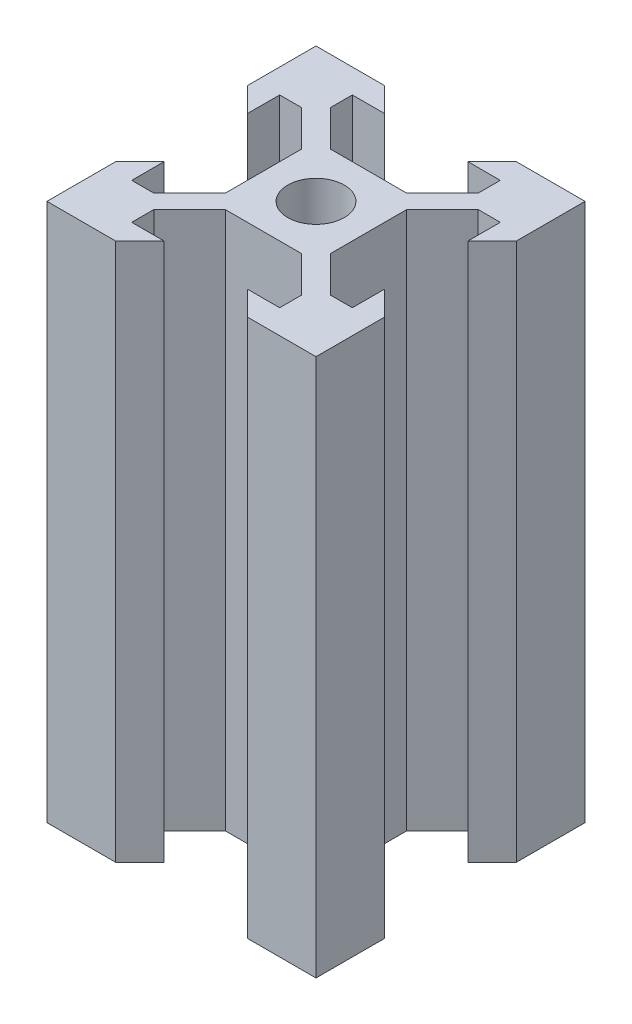
from build123d import *

# Parameters (mm, degrees)
SKETCH1_R           = 2.1
BOSS_EXTRUDE1_DEPTH = 40


with BuildPart() as part:
    # Sketch1 → Boss-Extrude1 (new body)
    with BuildSketch(Plane(origin=(0, 0, 0), x_dir=(1, 0, 0), z_dir=(0, 1, 0))):
        Polygon((-3.900660172, -2.84), (-3.900660172, 0), (-3.900660172, 2.84), (-6.56, 5.499339828), (-8.2, 5.499339828), (-8.2, 3.1), (-10, 4.9), (-10, 10), (-4.9, 10), (-3.1, 8.2), (-5.499339828, 8.2), (-5.499339828, 6.56), (-2.84, 3.900660172), (0, 3.900660172), (2.84, 3.900660172), (5.499339828, 6.56), (5.499339828, 8.2), (3.1, 8.2), (4.9, 10), (10, 10), (10, 4.9), (8.2, 3.1), (8.2, 5.499339828), (6.56, 5.499339828), (3.900660172, 2.84), (3.900660172, 0), (3.900660172, -2.84), (6.56, -5.499339828), (8.2, -5.499339828), (8.2, -3.1), (10, -4.9), (10, -10), (4.9, -10), (3.1, -8.2), (5.499339828, -8.2), (5.499339828, -6.56), (2.84, -3.900660172), (0, -3.900660172), (-2.84, -3.900660172), (-5.499339828, -6.56), (-5.499339828, -8.2), (-3.1, -8.2), (-4.9, -10), (-10, -10), (-10, -4.9), (-8.2, -3.1), (-8.2, -5.499339828), (-6.56, -5.499339828), align=None)
        with Locations(Location((0, 0, 0), (0, 0, 270))):
            Circle(SKETCH1_R, mode=Mode.SUBTRACT)
    extrude(amount=BOSS_EXTRUDE1_DEPTH)


solid = part.part
